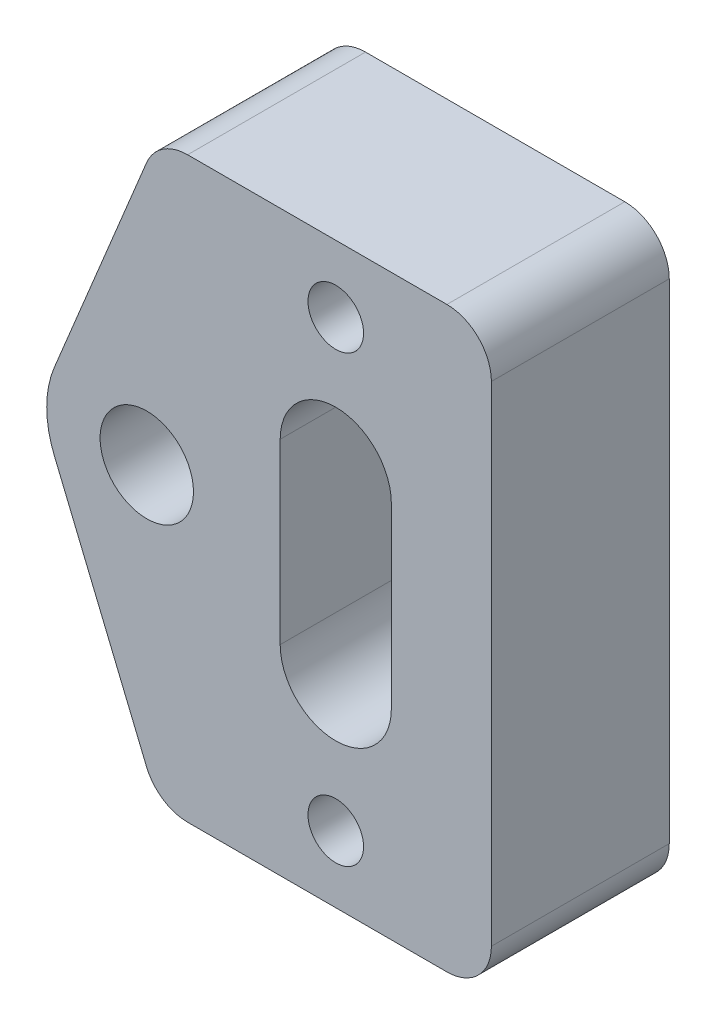
from build123d import *

# Parameters (mm, degrees)
SKETCH_1_R             = 1.5
EXTRUDE_1_DEPTH        = 8
SKETCH_2_R             = 1
CUT_EXTRUDE_1_DEPTH    = 33
FILLET_1_R             = 2
HOLE_WIZARD_M3_1_D     = 2.5
EXTRUDE_START          = 2.3
SKETCH_8_R             = 4.5
SKETCH_8_R_2           = 1.5
EXTRUDE_2_DEPTH        = 2.3
HOLE_WIZARD_M5_1_D     = 4.2
HOLE_WIZARD_M5_1_DEPTH = 20
HOLE_WIZARD_M5_1_TIP   = 1.2618073
CUT_EXTRUDE_2_DEPTH    = 20


with BuildPart() as part:
    # 草图1 → 凸台-拉伸1 (new body)
    with BuildSketch(Plane.XY):
        with BuildLine():
            Line((0.5, -13), (15.5, -13))
            Line((15.5, -13), (15.5, 13))
            Line((15.5, 13), (0.5, 13))
            Line((0.5, 13), (-4.159282148, 1.717664698))
            ThreePointArc((-4.159282148, 1.717664698), (-4.5, 0), (-4.159282148, -1.717664698))
            Line((-4.159282148, -1.717664698), (0.5, -13))
        make_face()
        Circle(SKETCH_1_R, mode=Mode.SUBTRACT)
    extrude(amount=EXTRUDE_1_DEPTH)

    # 草图2 → 切除-拉伸1 (cut)
    with BuildSketch(Plane.XY.offset(8)):
        with Locations((8.5, 10)):
            Circle(SKETCH_2_R)
        with Locations((8.5, -10)):
            Circle(SKETCH_2_R)
    extrude(amount=-CUT_EXTRUDE_1_DEPTH, mode=Mode.SUBTRACT)

    # 圆角1
    fillet_1_edges = [part.edges().sort_by_distance(p)[0] for p in [
        (0.5, 13, 4),
        (15.5, 13, 4),
        (15.5, -13, 4),
        (0.5, -13, 4),
    ]]
    fillet(fillet_1_edges, radius=FILLET_1_R)

    # M3 螺纹孔1 (through all)
    with Locations(Plane.XY.offset(8)):
        with Locations((8.5, 10), (8.5, -10)):
            Hole(HOLE_WIZARD_M3_1_D / 2)

    # 草图8 → 凸台-拉伸2 (add)
    with BuildSketch(Plane(origin=(0, 0, 0), x_dir=(-1, 0, 0), z_dir=(0, 0, -1)).offset(EXTRUDE_START)):
        Circle(SKETCH_8_R)
        Circle(SKETCH_8_R_2, mode=Mode.SUBTRACT)
    extrude(amount=-EXTRUDE_2_DEPTH)

    # M5 螺纹孔1
    with Locations(Plane.XY.offset(8)):
        with Locations((0, 0)):
            Hole(HOLE_WIZARD_M5_1_D / 2, depth=HOLE_WIZARD_M5_1_DEPTH)
            with Locations((0, 0, -(HOLE_WIZARD_M5_1_DEPTH + HOLE_WIZARD_M5_1_TIP / 2))):  # 118° drill point
                Cone(0, HOLE_WIZARD_M5_1_D / 2, HOLE_WIZARD_M5_1_TIP, mode=Mode.SUBTRACT)

    # 草图12 → 切除-拉伸2 (cut)
    with BuildSketch(Plane(origin=(0, 0, 0), x_dir=(-1, 0, 0), z_dir=(0, 0, -1))):
        with BuildLine():
            Line((-6, 4), (-6, -4))
            ThreePointArc((-6, -4), (-8.5, -6.5), (-11, -4))
            Line((-11, -4), (-11, 4))
            ThreePointArc((-11, 4), (-8.5, 6.5), (-6, 4))
        make_face()
    extrude(amount=-CUT_EXTRUDE_2_DEPTH, mode=Mode.SUBTRACT)


solid = part.part
